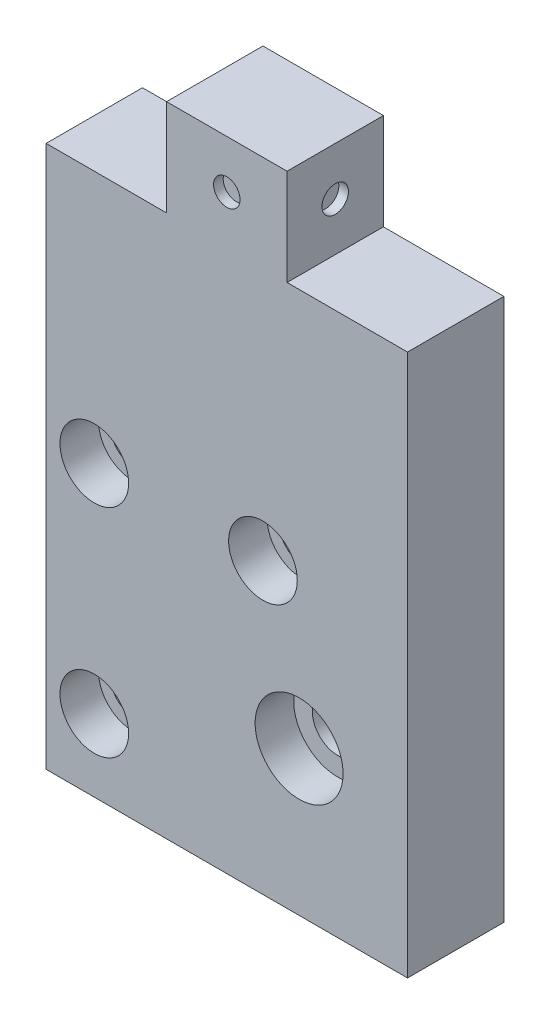
from build123d import *

# Parameters (mm, degrees)
SKETCH1_R           = 2.286
SKETCH1_R_2         = 2.667
BOSS_EXTRUDE1_DEPTH = 10.16
SKETCH7_R           = 3.6195
SKETCH7_R_2         = 4.6355
CUT_EXTRUDE1_DEPTH  = 4.064
SKETCH3_R           = 1.397
CUT_EXTRUDE2_DEPTH  = 1.016
SKETCH8_R           = 1.397
CUT_EXTRUDE3_DEPTH  = 1.016
CUT_EXTRUDE4_START  = -1.016
SKETCH9_R           = 1.397
CUT_EXTRUDE4_DEPTH  = 1.016


with BuildPart() as part:
    # Sketch1 → Boss-Extrude1 (new body)
    with BuildSketch(Plane.XY):
        Polygon((0, 57.15), (12.7, 57.15), (12.7, 67.31), (25.4, 67.31), (25.4, 57.15), (38.1, 57.15), (38.1, 0), (0, 0), align=None)
        with Locations((5.08, 7.62)):
            Circle(SKETCH1_R, mode=Mode.SUBTRACT)
        with Locations((5.08, 30.48)):
            Circle(SKETCH1_R, mode=Mode.SUBTRACT)
        with Locations((26.67, 15.24)):
            Circle(SKETCH1_R_2, mode=Mode.SUBTRACT)
        with Locations((22.86, 30.48)):
            Circle(SKETCH1_R, mode=Mode.SUBTRACT)
    extrude(amount=BOSS_EXTRUDE1_DEPTH)

    # Sketch7 → Cut-Extrude1 (cut)
    with BuildSketch(Plane.XY.offset(10.16)):
        with Locations((5.08, 30.48)):
            Circle(SKETCH7_R)
        with Locations((22.86, 30.48)):
            Circle(SKETCH7_R)
        with Locations((5.08, 7.62)):
            Circle(SKETCH7_R)
        with Locations((26.67, 15.24)):
            Circle(SKETCH7_R_2)
    extrude(amount=-CUT_EXTRUDE1_DEPTH, mode=Mode.SUBTRACT)

    # Sketch3 → Cut-Extrude2 (cut)
    with BuildSketch(Plane(origin=(0, 0, 10.16), x_dir=(-1, 0, 0), z_dir=(0, 0, -1))):
        with Locations((-19.05, 62.23)):
            Circle(SKETCH3_R)
    extrude(amount=CUT_EXTRUDE2_DEPTH, mode=Mode.SUBTRACT)

    # Sketch8 → Cut-Extrude3 (cut)
    with BuildSketch(Plane(origin=(25.4, 0, 0), x_dir=(0, 0, -1), z_dir=(1, 0, 0))):
        with Locations((-5.08, 62.23)):
            Circle(SKETCH8_R)
    extrude(amount=-CUT_EXTRUDE3_DEPTH, mode=Mode.SUBTRACT)

    # Sketch9 → Cut-Extrude4 (cut)
    with BuildSketch(Plane.ZY.offset(-12.7).offset(CUT_EXTRUDE4_START)):
        with Locations(Location((5.08, 62.23, 0), (0, 0, 180))):
            Circle(SKETCH9_R)
    extrude(amount=CUT_EXTRUDE4_DEPTH, mode=Mode.SUBTRACT)


solid = part.part
